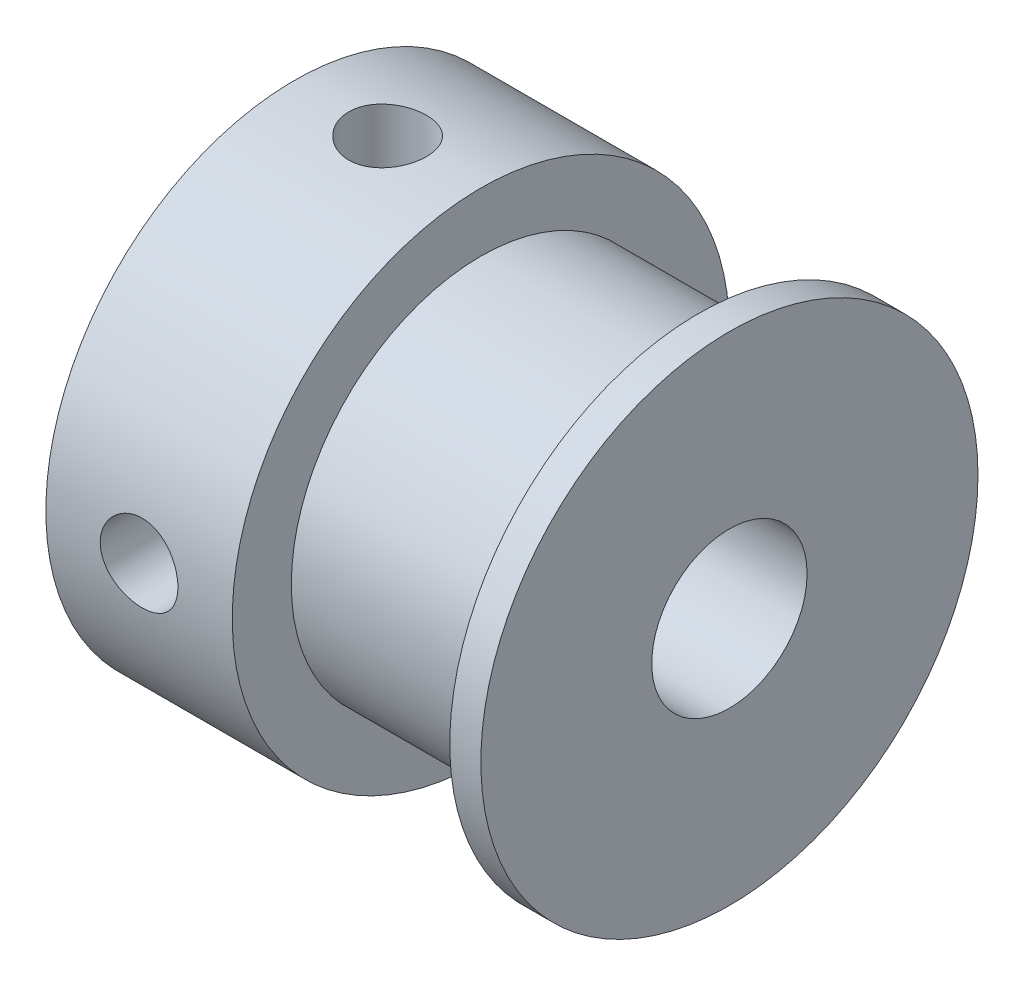
from build123d import *

# Parameters (mm, degrees)
SKETCH2_W = 1.25
SKETCH2_H = 8
SKETCH4_W = 1.25
SKETCH4_H = 8


with BuildPart() as part:
    # Sketch1 → Revolve1 (revolve)
    with BuildSketch(Plane.XY, mode=Mode.PRIVATE) as revolve1_sk:
        Polygon((0, 2.5), (0, 8), (6, 8), (6, 6.1), (13, 6.1), (13, 8), (14, 8), (14, 2.5), align=None)
    revolve(revolve1_sk.sketch.rotate(Axis((0, 0, 0), (-1, 0, 0)), 90), axis=Axis((0, 0, 0), (-1, 0, 0)))

    # Sketch2 → M3x0.5 Tapped Hole1 (revolve, cut)
    with BuildSketch(Plane(origin=(3, 0, 0), x_dir=(0, 0, -1), z_dir=(1, 0, 0))):
        with Locations((0.625, 4)):
            Rectangle(SKETCH2_W, SKETCH2_H)
    revolve(axis=Axis((3, -6.35, 0), (0, 1, 0)), mode=Mode.SUBTRACT)

    # Sketch4 → M3x0.5 Tapped Hole2 (revolve, cut)
    with BuildSketch(Plane.YZ.offset(3)):
        with Locations((0.625, 4)):
            Rectangle(SKETCH4_W, SKETCH4_H)
    revolve(axis=Axis((3, 0, -6.35), (0, 0, 1)), mode=Mode.SUBTRACT)


solid = part.part
